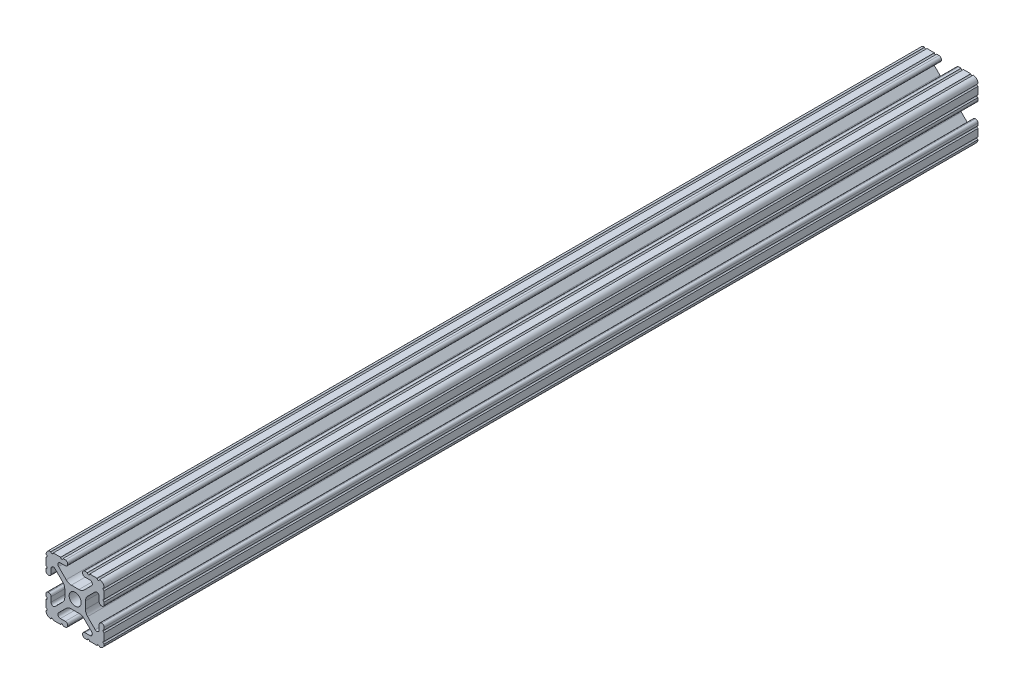
from build123d import *

# Parameters (mm, degrees)
SKETCH1_R           = 2.6035
BOSS_EXTRUDE1_DEPTH = 304.8
SKETCH2_W           = 198.440475905
SKETCH2_H           = 127.716556881
CUT_EXTRUDE1_DEPTH  = 228.6


with BuildPart() as part:
    # Sketch1 → Boss-Extrude1 (new, symmetric)
    with BuildSketch(Plane.XY):
        with BuildLine():
            Line((-7.179650497, -8.645192506), (-3.952270251, -5.423690499))
            ThreePointArc((-3.952270251, -5.423690499), (-2.922936451, -4.736929036), (-1.709253557, -4.4958))
            Line((-1.709253557, -4.4958), (1.709253557, -4.4958))
            ThreePointArc((1.709253557, -4.4958), (2.922936451, -4.736929036), (3.952270251, -5.423690499))
            Line((3.952270251, -5.423690499), (7.179650497, -8.645192506))
            ThreePointArc((7.179650497, -8.645192506), (7.41473083, -9.822813117), (6.416408329, -10.4902))
            Line((6.416408329, -10.4902), (4.287512407, -10.4902))
            ThreePointArc((4.287512407, -10.4902), (3.54574862, -10.79744862), (3.2385, -11.539212407))
            Line((3.2385, -11.539212407), (3.2385, -11.650987593))
            ThreePointArc((3.2385, -11.650987593), (3.54574862, -12.39275138), (4.287512407, -12.7))
            Line((4.287512407, -12.7), (5.317126718, -12.7))
            ThreePointArc((5.317126718, -12.7), (5.825126718, -12.192), (6.333126718, -12.7))
            Line((6.333126718, -12.7), (9.550443118, -12.7))
            ThreePointArc((9.550443118, -12.7), (10.058366869, -12.192000006), (10.566443095, -12.699847501))
            ThreePointArc((10.566443095, -12.699847501), (12.082537762, -12.08250727), (12.699846982, -10.566399977))
            ThreePointArc((12.699846982, -10.566399977), (12.192000006, -10.058323491), (12.7, -9.5504))
            Line((12.7, -9.5504), (12.7, -6.3330836))
            ThreePointArc((12.7, -6.3330836), (12.192, -5.8250836), (12.7, -5.3170836))
            Line((12.7, -5.3170836), (12.7, -4.287469289))
            ThreePointArc((12.7, -4.287469289), (12.39275138, -3.545705502), (11.650987593, -3.238456882))
            Line((11.650987593, -3.238456882), (11.539212407, -3.238456882))
            ThreePointArc((11.539212407, -3.238456882), (10.79744862, -3.545705502), (10.4902, -4.287469289))
            Line((10.4902, -4.287469289), (10.4902, -6.402089023))
            ThreePointArc((10.4902, -6.402089023), (9.856505071, -7.351067942), (8.737131347, -7.129408934))
            Line((8.737131347, -7.129408934), (5.441005833, -3.840816462))
            ThreePointArc((5.441005833, -3.840816462), (4.750877967, -2.809883091), (4.5085, -1.593185507))
            Line((4.5085, -1.593185507), (4.5085, 1.593185507))
            ThreePointArc((4.5085, 1.593185507), (4.750877967, 2.809883091), (5.441005833, 3.840816462))
            Line((5.441005833, 3.840816462), (8.737131347, 7.129408934))
            ThreePointArc((8.737131347, 7.129408934), (9.856505071, 7.351067942), (10.4902, 6.402089023))
            Line((10.4902, 6.402089023), (10.4902, 4.287469289))
            ThreePointArc((10.4902, 4.287469289), (10.79744862, 3.545705502), (11.539212407, 3.238456882))
            Line((11.539212407, 3.238456882), (11.650987593, 3.238456882))
            ThreePointArc((11.650987593, 3.238456882), (12.39275138, 3.545705502), (12.7, 4.287469289))
            Line((12.7, 4.287469289), (12.7, 5.3170836))
            ThreePointArc((12.7, 5.3170836), (12.192, 5.8250836), (12.7, 6.3330836))
            Line((12.7, 6.3330836), (12.7, 9.5504))
            ThreePointArc((12.7, 9.5504), (12.192000006, 10.058323491), (12.699846982, 10.566399977))
            ThreePointArc((12.699846982, 10.566399977), (12.082537762, 12.08250727), (10.566443095, 12.699847501))
            ThreePointArc((10.566443095, 12.699847501), (10.058366869, 12.192000006), (9.550443118, 12.7))
            Line((9.550443118, 12.7), (6.333126718, 12.7))
            ThreePointArc((6.333126718, 12.7), (5.825126718, 12.192), (5.317126718, 12.7))
            Line((5.317126718, 12.7), (4.287512407, 12.7))
            ThreePointArc((4.287512407, 12.7), (3.54574862, 12.39275138), (3.2385, 11.650987593))
            Line((3.2385, 11.650987593), (3.2385, 11.539212407))
            ThreePointArc((3.2385, 11.539212407), (3.54574862, 10.79744862), (4.287512407, 10.4902))
            Line((4.287512407, 10.4902), (6.476788598, 10.4902))
            ThreePointArc((6.476788598, 10.4902), (7.432222385, 9.85140422), (7.207036008, 8.724370562))
            Line((7.207036008, 8.724370562), (3.898272566, 5.423169045))
            ThreePointArc((3.898272566, 5.423169045), (2.869120213, 4.736787962), (1.655778399, 4.4958))
            Line((1.655778399, 4.4958), (-1.655778399, 4.4958))
            ThreePointArc((-1.655778399, 4.4958), (-2.869120213, 4.736787962), (-3.898272566, 5.423169045))
            Line((-3.898272566, 5.423169045), (-7.207036008, 8.724370562))
            ThreePointArc((-7.207036008, 8.724370562), (-7.432222385, 9.85140422), (-6.476788598, 10.4902))
            Line((-6.476788598, 10.4902), (-4.287512407, 10.4902))
            ThreePointArc((-4.287512407, 10.4902), (-3.54574862, 10.79744862), (-3.2385, 11.539212407))
            Line((-3.2385, 11.539212407), (-3.2385, 11.650987593))
            ThreePointArc((-3.2385, 11.650987593), (-3.54574862, 12.39275138), (-4.287512407, 12.7))
            Line((-4.287512407, 12.7), (-5.317126718, 12.7))
            ThreePointArc((-5.317126718, 12.7), (-5.825126718, 12.192), (-6.333126718, 12.7))
            Line((-6.333126718, 12.7), (-9.550443118, 12.7))
            ThreePointArc((-9.550443118, 12.7), (-10.058366869, 12.192000006), (-10.566443095, 12.699847501))
            ThreePointArc((-10.566443095, 12.699847501), (-12.082537762, 12.08250727), (-12.699846982, 10.566399977))
            ThreePointArc((-12.699846982, 10.566399977), (-12.192000006, 10.058323491), (-12.7, 9.5504))
            Line((-12.7, 9.5504), (-12.7, 6.3330836))
            ThreePointArc((-12.7, 6.3330836), (-12.192, 5.8250836), (-12.7, 5.3170836))
            Line((-12.7, 5.3170836), (-12.7, 4.287469289))
            ThreePointArc((-12.7, 4.287469289), (-12.39275138, 3.545705502), (-11.650987593, 3.238456882))
            Line((-11.650987593, 3.238456882), (-11.539212407, 3.238456882))
            ThreePointArc((-11.539212407, 3.238456882), (-10.79744862, 3.545705502), (-10.4902, 4.287469289))
            Line((-10.4902, 4.287469289), (-10.4902, 6.402089023))
            ThreePointArc((-10.4902, 6.402089023), (-9.856505071, 7.351067942), (-8.737131347, 7.129408934))
            Line((-8.737131347, 7.129408934), (-5.441005833, 3.840816462))
            ThreePointArc((-5.441005833, 3.840816462), (-4.750877967, 2.809883091), (-4.5085, 1.593185507))
            Line((-4.5085, 1.593185507), (-4.5085, -1.593185507))
            ThreePointArc((-4.5085, -1.593185507), (-4.750877967, -2.809883091), (-5.441005833, -3.840816462))
            Line((-5.441005833, -3.840816462), (-8.737131347, -7.129408934))
            ThreePointArc((-8.737131347, -7.129408934), (-9.856505071, -7.351067942), (-10.4902, -6.402089023))
            Line((-10.4902, -6.402089023), (-10.4902, -4.287469289))
            ThreePointArc((-10.4902, -4.287469289), (-10.79744862, -3.545705502), (-11.539212407, -3.238456882))
            Line((-11.539212407, -3.238456882), (-11.650987593, -3.238456882))
            ThreePointArc((-11.650987593, -3.238456882), (-12.39275138, -3.545705502), (-12.7, -4.287469289))
            Line((-12.7, -4.287469289), (-12.7, -5.3170836))
            ThreePointArc((-12.7, -5.3170836), (-12.192, -5.8250836), (-12.7, -6.3330836))
            Line((-12.7, -6.3330836), (-12.7, -9.5504))
            ThreePointArc((-12.7, -9.5504), (-12.192000006, -10.058323491), (-12.699846982, -10.566399977))
            ThreePointArc((-12.699846982, -10.566399977), (-12.082537762, -12.08250727), (-10.566443095, -12.699847501))
            ThreePointArc((-10.566443095, -12.699847501), (-10.058366869, -12.192000006), (-9.550443118, -12.7))
            Line((-9.550443118, -12.7), (-6.333126718, -12.7))
            ThreePointArc((-6.333126718, -12.7), (-5.825126718, -12.192), (-5.317126718, -12.7))
            Line((-5.317126718, -12.7), (-4.287512407, -12.7))
            ThreePointArc((-4.287512407, -12.7), (-3.54574862, -12.39275138), (-3.2385, -11.650987593))
            Line((-3.2385, -11.650987593), (-3.2385, -11.539212407))
            ThreePointArc((-3.2385, -11.539212407), (-3.54574862, -10.79744862), (-4.287512407, -10.4902))
            Line((-4.287512407, -10.4902), (-6.416408329, -10.4902))
            ThreePointArc((-6.416408329, -10.4902), (-7.41473083, -9.822813117), (-7.179650497, -8.645192506))
        make_face()
        with Locations(Location((0, 0, 0), (0, 0, 180))):
            Circle(SKETCH1_R, mode=Mode.SUBTRACT)
    extrude(amount=BOSS_EXTRUDE1_DEPTH, both=True)

    # Sketch2 → Cut-Extrude1 (cut)
    with BuildSketch(Plane.XY.offset(304.8)):
        with Locations((9.262304792, -13.099521951)):
            Rectangle(SKETCH2_W, SKETCH2_H)
    extrude(amount=-CUT_EXTRUDE1_DEPTH, mode=Mode.SUBTRACT)


solid = part.part
